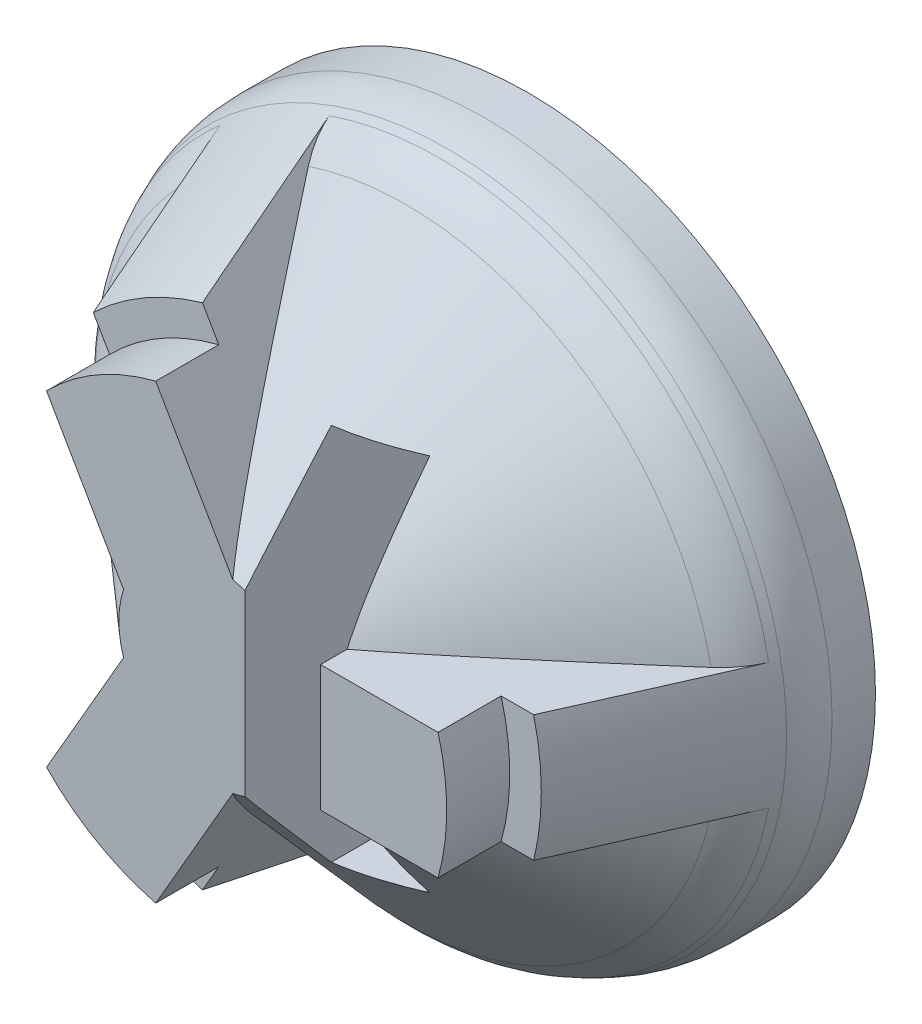
from build123d import *
from build123d.topology import SkipClean

# Parameters (mm, degrees)
BOSS_EXTRU_1_DEPTH      = 10
ESQUISSE5_R             = 10.2
ENL_V_MAT_EXTRU_1_DEPTH = 1
CONG_2_R                = 3
ESQUISSE7_W             = 2.4
ESQUISSE7_H             = 12
ENL_V_MAT_EXTRU_2_DEPTH = 8


with BuildPart() as part:
    # Esquisse1 → Boss.-Extru.1 (new body)
    with BuildSketch(Plane.XY):
        with BuildLine():
            ThreePointArc((0.614016819, 2.936491673), (1.070466269, 2.802517077), (1.5, 2.598076211))
            ThreePointArc((1.5, 2.598076211), (1.891817848, 2.328309522), (2.236067977, 2))
            Line((2.236067977, 2), (11.832159566, 2))
            ThreePointArc((11.832159566, 2), (12, 0), (11.832159566, -2))
            Line((11.832159566, -2), (2.236067977, -2))
            ThreePointArc((2.236067977, -2), (1.891817848, -2.328309522), (1.5, -2.598076211))
            ThreePointArc((1.5, -2.598076211), (1.070466269, -2.802517077), (0.614016819, -2.936491673))
            Line((0.614016819, -2.936491673), (-4.184028976, -11.246950766))
            ThreePointArc((-4.184028976, -11.246950766), (-6, -10.392304845), (-7.648130591, -9.246950766))
            Line((-7.648130591, -9.246950766), (-2.850084796, -0.936491673))
            ThreePointArc((-2.850084796, -0.936491673), (-2.962284118, -0.474207555), (-3, 0))
            ThreePointArc((-3, 0), (-2.962284118, 0.474207555), (-2.850084796, 0.936491673))
            Line((-2.850084796, 0.936491673), (-7.648130591, 9.246950766))
            ThreePointArc((-7.648130591, 9.246950766), (-6, 10.392304845), (-4.184028976, 11.246950766))
            Line((-4.184028976, 11.246950766), (0.614016819, 2.936491673))
        make_face()
    extrude(amount=BOSS_EXTRU_1_DEPTH)

    # Esquisse4 → Révolution1 (revolve)
    with SkipClean():  # the faces are left unmerged after this step: merging them gives an invalid solid
        with BuildSketch(Plane(origin=(0, 0, 0), x_dir=(1, 0, 0), z_dir=(0, 1, 0)), mode=Mode.PRIVATE) as r_volution1_sk:
            Polygon((3, -10), (0, -10), (0, 0), (12, 0), (12, -2), align=None)
        revolve(r_volution1_sk.sketch.rotate(Axis((0, 0, 10), (0, 0, -1)), 129.594068227), axis=Axis((0, 0, 10), (0, 0, -1)))

    # Esquisse5 → Enlèv. mat.-Extru.1 (cut)
    with SkipClean():  # the faces are left unmerged after this step: merging them gives an invalid solid
        with BuildSketch(Plane(origin=(0, 0, 0), x_dir=(-1, 0, 0), z_dir=(0, 0, -1))):
            Circle(ESQUISSE5_R)
        extrude(amount=-ENL_V_MAT_EXTRU_1_DEPTH, mode=Mode.SUBTRACT)

    # Esquisse6 → Enlèvement de matière-Révolution1 (revolve, cut)
    with BuildSketch(Plane(origin=(0, 0, 0), x_dir=(1, 0, 0), z_dir=(0, 1, 0)), mode=Mode.PRIVATE) as enl_vement_de_mati_re_r_volution1_sk:
        Polygon((11, 0), (15.480754368, 0), (15.480754368, -10), (7.75, -10), (7.4, -10), (7.4, -8), (8.4, -8), (11, -2), align=None)
    revolve(enl_vement_de_mati_re_r_volution1_sk.sketch.rotate(Axis((0, 0, 0), (0, 0, 1)), 180), axis=Axis((0, 0, 0), (0, 0, 1)), mode=Mode.SUBTRACT)

    # Congé2
    cong_2_edges = [part.edges().sort_by_distance(p)[0] for p in [
        (5.186746988, -8.983709309, 3.445783133),
        (-9.443834359, -4.292245317, 3.445783133),
        (5.186746988, 8.983709309, 3.445783133),
        (11, 0, 2),
    ]]
    fillet(cong_2_edges, radius=CONG_2_R)

    # Esquisse7 → Enlèv. mat.-Extru.2 (cut)
    with BuildSketch(Plane.XY.offset(10)):
        with Locations((2.2, 0)):
            Rectangle(ESQUISSE7_W, ESQUISSE7_H)
    extrude(amount=-ENL_V_MAT_EXTRU_2_DEPTH, mode=Mode.SUBTRACT)


solid = part.part
